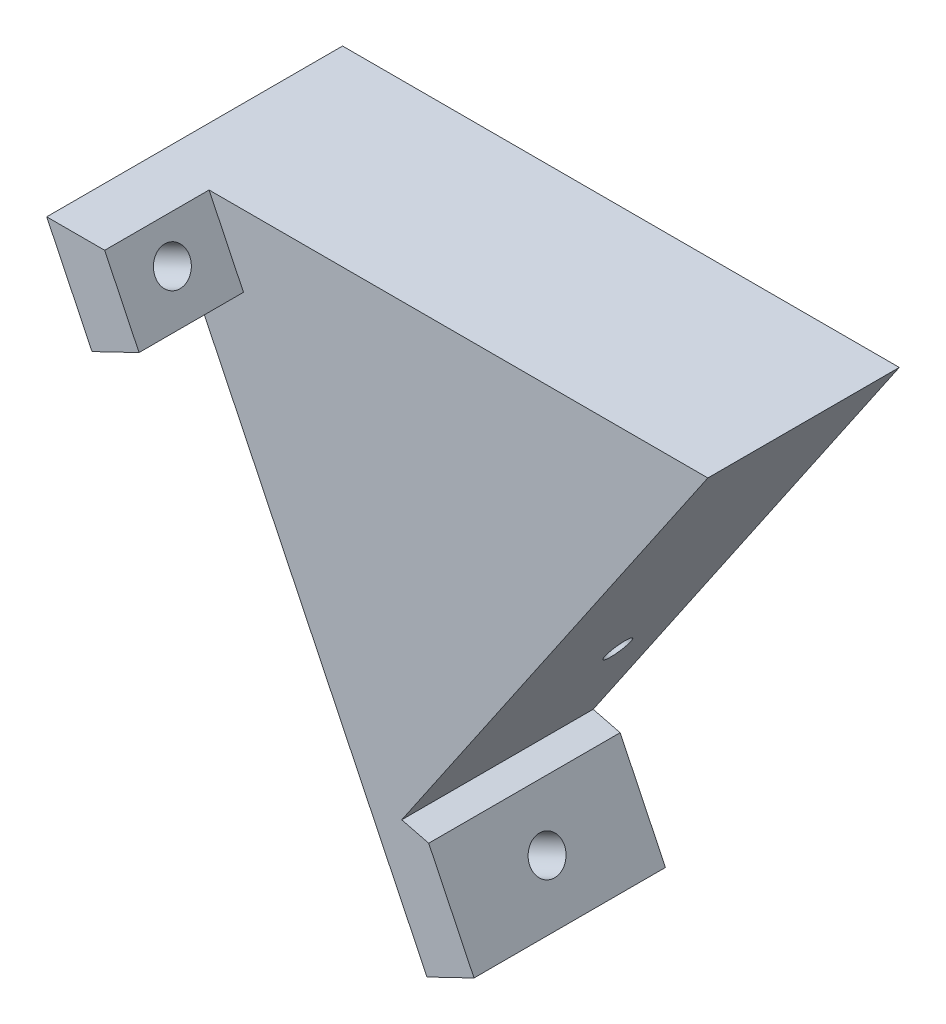
from build123d import *

# Parameters (mm, degrees)
BOSS_EXTRUDE1_DEPTH = 22
SKETCH6_W           = 12
SKETCH6_H           = 12
SKETCH6_W_2         = 22
BOSS_EXTRUDE4_DEPTH = 6
BOSS_EXTRUDE5_DEPTH = 22
SKETCH9_R           = 2
CUT_EXTRUDE9_DEPTH  = 6
SKETCH10_R          = 1.5
CUT_EXTRUDE10_DEPTH = 36
CUT_EXTRUDE11_DEPTH = 20


with BuildPart() as part:
    # Sketch1 → Boss-Extrude1 (new body)
    with BuildSketch(Plane.XY):
        Polygon((-36.238637744, 24.241346543), (-9.742760301, -30.758653457), (27.744579766, 24.241346543), align=None)
    extrude(amount=BOSS_EXTRUDE1_DEPTH)

    # Sketch6 → Boss-Extrude4 (add)
    with BuildSketch(Plane(origin=(-19.934259386, -9.603194429, 0), x_dir=(0, 0, 1), z_dir=(-0.9009094793526655, -0.4340070391278342, 0))):
        with Locations((28, 31.567082762)):
            Rectangle(SKETCH6_W, SKETCH6_H)
        with Locations((11, -29.48233592)):
            Rectangle(SKETCH6_W_2, SKETCH6_H)
    extrude(amount=-BOSS_EXTRUDE4_DEPTH)


with BuildPart() as boss_extrude4_piece_1:
    # of the separate pieces the step leaves, piece 1, a body of its own (boss_extrude4_pieces)
    add(part.part.solids().sort_by_distance((-36.238637744, 24.241346543, 0))[0])



with BuildPart() as boss_extrude4_piece_2:
    # of the separate pieces the step leaves, piece 2, a body of its own (boss_extrude4_pieces)
    add(part.part.solids().sort_by_distance((-4.337303425, -28.154611222, 0))[0])


with BuildPart() as boss_extrude4_piece_1_1:
    add(boss_extrude4_piece_1.part)

    add(boss_extrude4_piece_2.part)  # Boss-Extrude5 merges Boss-Extrude4 piece 2
    # Sketch8 → Boss-Extrude5 (add)
    with BuildSketch(Plane(origin=(0, 0, 0), x_dir=(-1, 0, 0), z_dir=(0, 0, -1))):
        Polygon((9.742760301, -30.758653457), (4.337303425, -28.154611222), (7.436392988, -27.374839027), align=None)
    extrude(amount=-BOSS_EXTRUDE5_DEPTH)

    # Sketch9 → Cut-Extrude9 (cut)
    with BuildSketch(Plane(origin=(-14.52880251, -6.999152194, 0), x_dir=(0, 0, -1), z_dir=(0.9009094793526653, 0.43400703912783434, 0))):
        with Locations(Location((-28, 30.567082762, 0), (0, 0, 90))):
            Circle(SKETCH9_R)
        with Locations(Location((-11, -29.48233592, 0), (0, 0, 90))):
            Circle(SKETCH9_R)
    extrude(amount=-CUT_EXTRUDE9_DEPTH, mode=Mode.SUBTRACT)

    # Sketch10 → Cut-Extrude10 (cut)
    with BuildSketch(Plane(origin=(7.662336774, -5.222556806, 0), x_dir=(0, 0, -1), z_dir=(0.8263158609823067, -0.5632069760656995, 0))):
        with Locations(Location((-7, -9.343049988, 0), (0, 0, 90))):
            Circle(SKETCH10_R)
    extrude(amount=-CUT_EXTRUDE10_DEPTH, mode=Mode.SUBTRACT)

    # Sketch12 → Cut-Extrude11 (cut)
    with BuildSketch(Plane(origin=(0, 0, 22), x_dir=(-1, 0, 0), z_dir=(0, 0, -1))):
        Polygon((30.833180868, 26.845388778), (29.578701161, 24.241346543), (36.238637744, 24.241346543), align=None)
    extrude(amount=-CUT_EXTRUDE11_DEPTH, mode=Mode.SUBTRACT)


solid = boss_extrude4_piece_1_1.part
